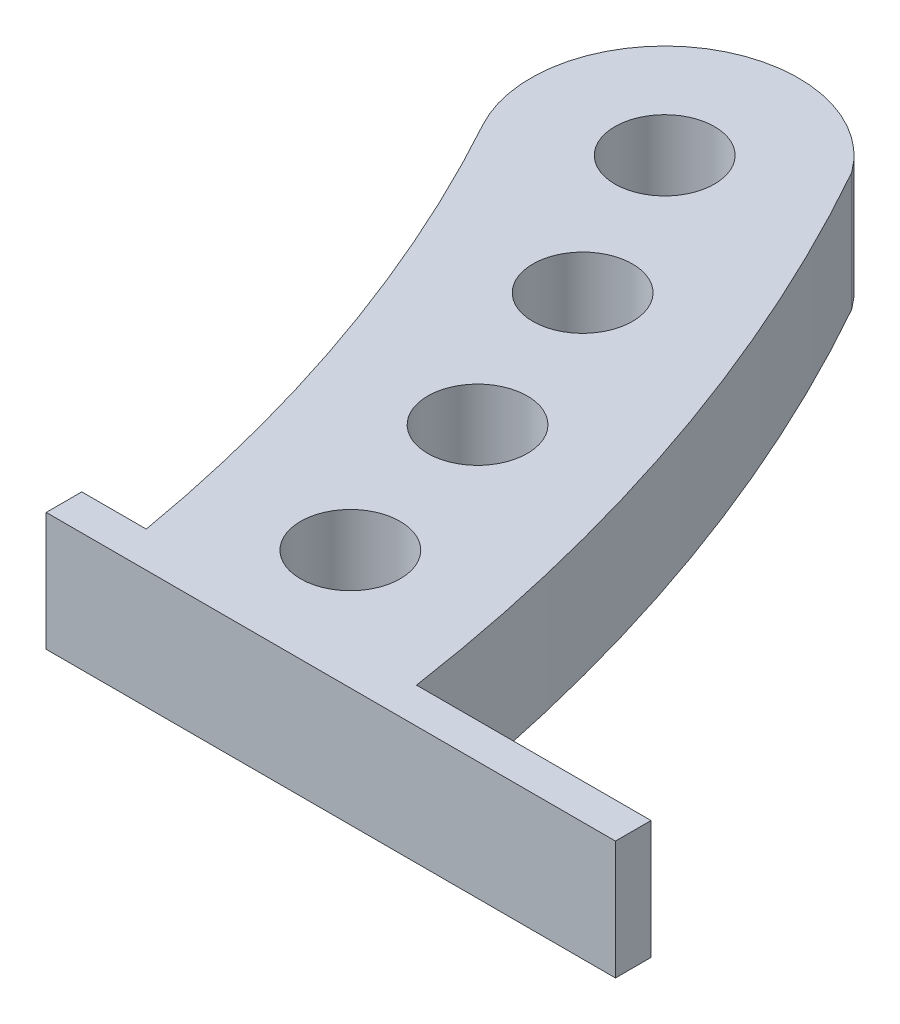
from build123d import *

# Parameters (mm, degrees)
SKETCH1_R           = 4.2
BOSS_EXTRUDE1_DEPTH = 10


with BuildPart() as part:
    # Sketch1 → Boss-Extrude1 (new body)
    with BuildSketch(Plane(origin=(0, 0, 0), x_dir=(1, 0, 0), z_dir=(0, 1, 0))):
        with BuildLine():
            Line((133, 24), (133, 21))
            Line((133, 21), (173, 21))
            Line((173, 21), (181, 21))
            Line((181, 21), (181, 24))
            Line((181, 24), (173, 24))
            Line((173, 24), (161.223447426, 24))
            ThreePointArc((161.223447426, 24), (154.671414284, 51.436889518), (143.48714405, 77.333301316))
            ThreePointArc((143.48714405, 77.333301316), (142.822320311, 78.554343107), (142.147106039, 79.769669954))
            ThreePointArc((142.147106039, 79.769669954), (126.959135765, 82.689852197), (123.107582845, 67.710952187))
            ThreePointArc((123.107582845, 67.710952187), (132.585040112, 46.491473825), (138.435002799, 24))
            Line((138.435002799, 24), (133, 24))
        make_face()
        with Locations(Location((148.576085497, 31.070096853, 0), (0, 0, 270))):
            Circle(SKETCH1_R, mode=Mode.SUBTRACT)
        with Locations(Location((144.782134175, 45.588789451, 0), (0, 0, 270))):
            Circle(SKETCH1_R, mode=Mode.SUBTRACT)
        with Locations(Location((139.573135396, 59.661913947, 0), (0, 0, 270))):
            Circle(SKETCH1_R, mode=Mode.SUBTRACT)
        with BuildLine():
            ThreePointArc((129.319915673, 71.127825148), (130.975900362, 76.832009114), (136.680084327, 75.176024425))
            ThreePointArc((136.680084327, 75.176024425), (137.067945069, 74.19682809), (137.2, 73.151924787))
            ThreePointArc((137.2, 73.151924787), (134.044903303, 69.083979717), (129.319915673, 71.127825148))
        make_face(mode=Mode.SUBTRACT)
    extrude(amount=BOSS_EXTRUDE1_DEPTH)


solid = part.part
